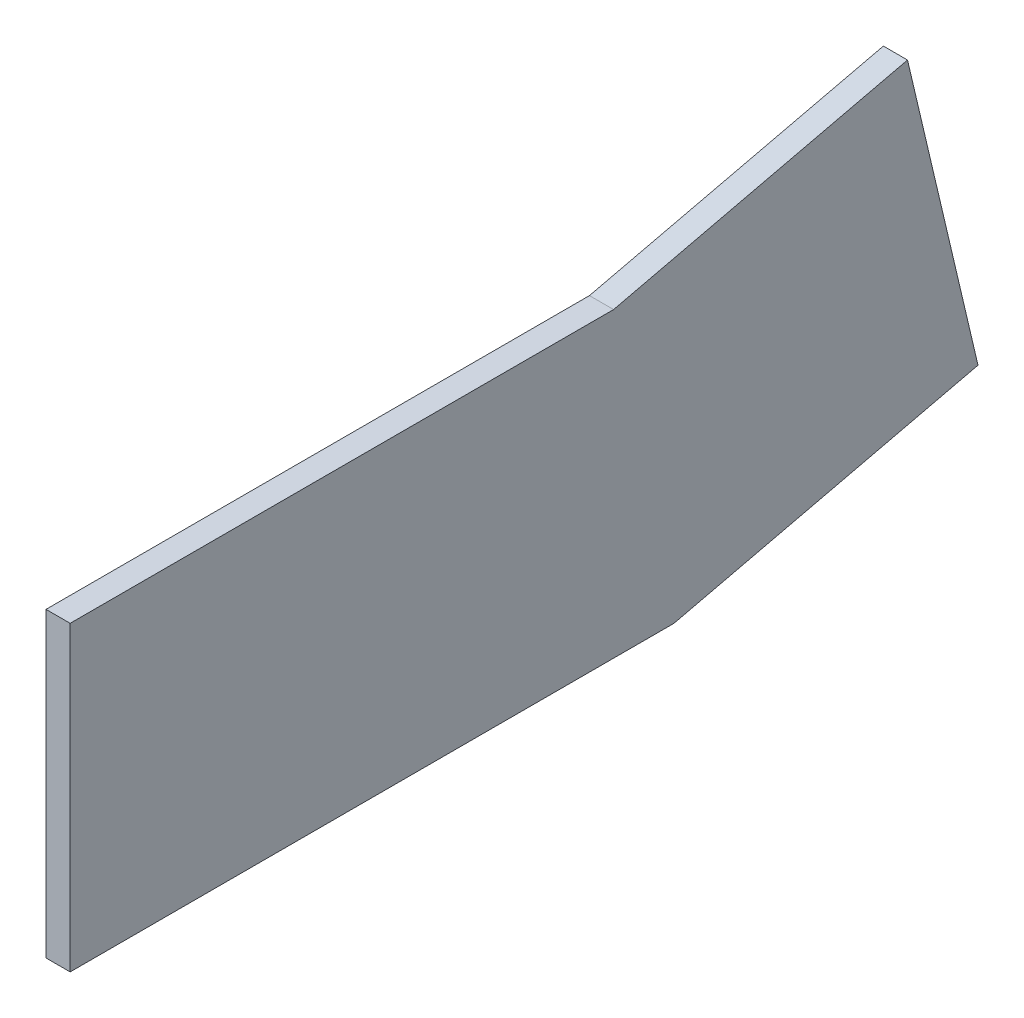
from build123d import *

# Parameters (mm, degrees)
BOSS_EXTRUDE1_DEPTH = 2


with BuildPart() as part:
    # Sketch1 → Boss-Extrude1 (new body)
    with BuildSketch(Plane(origin=(0, 0, 0), x_dir=(0, 0, -1), z_dir=(1, 0, 0))):
        Polygon((0, 0), (-25.171494782, -5.922704655), (-75.171494782, -5.922704655), (-75.171494782, 19.077295345), (-30.171494782, 19.077295345), (-5.836065574, 24.803278689), align=None)
    extrude(amount=BOSS_EXTRUDE1_DEPTH)


solid = part.part
